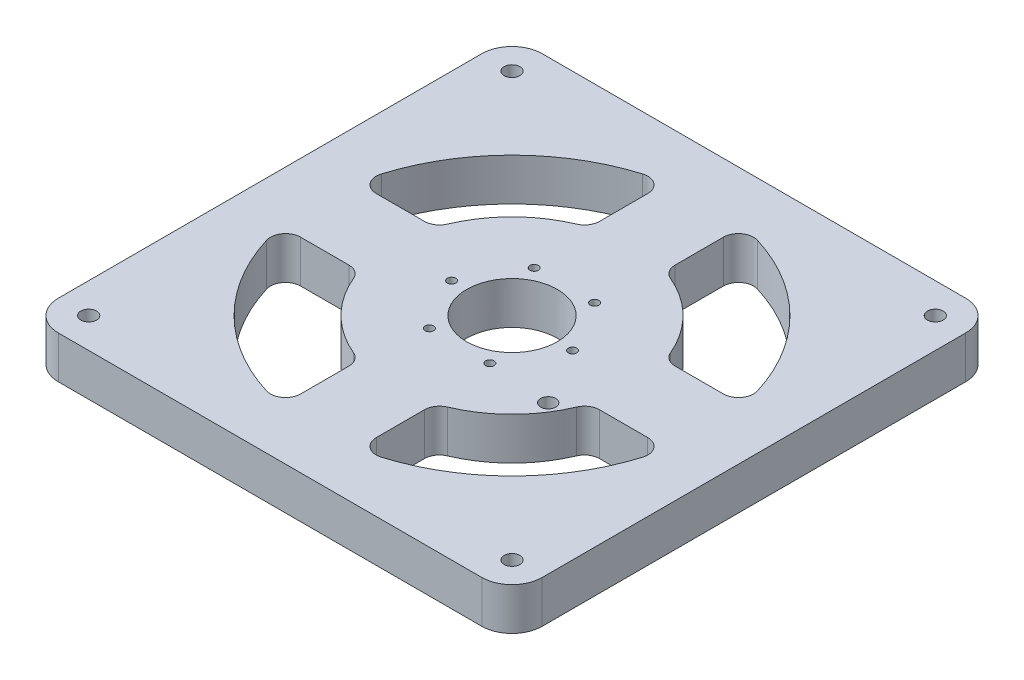
from build123d import *

# Parameters (mm, degrees)
SKETCH_1_W          = 160
SKETCH_1_H          = 160
EXTRUDE_1_DEPTH     = 14
SKETCH_2_R          = 15
SKETCH_2_R_2        = 1.4
CUT_EXTRUDE_1_DEPTH = 16
SKETCH_3_R          = 2.6
CUT_EXTRUDE_2_DEPTH = 20
FILLET_1_R          = 10
SKETCH_5_R          = 3.5
CUT_EXTRUDE_3_DEPTH = 4
CUT_EXTRUDE_4_DEPTH = 20
SKETCH_7_R          = 2.5
CUT_EXTRUDE_5_DEPTH = 20
FILLET_2_R          = 5
FILLET_3_R          = 5


with BuildPart() as part:
    # 草图1 → 凸台-拉伸1 (new body)
    with BuildSketch(Plane(origin=(0, 0, 0), x_dir=(1, 0, 0), z_dir=(0, 1, 0))):
        with Locations((80, 80)):
            Rectangle(SKETCH_1_W, SKETCH_1_H)
    extrude(amount=EXTRUDE_1_DEPTH)

    # 草图2 → 切除-拉伸1 (cut)
    with BuildSketch(Plane(origin=(0, 14, 0), x_dir=(1, 0, 0), z_dir=(0, 1, 0))):
        with Locations(Location((80, 80, 0), (0, 0, 270))):
            Circle(SKETCH_2_R)
        with Locations(Location((60, 80, 0), (0, 0, 270))):
            Circle(SKETCH_2_R_2)
        with Locations(Location((70, 97.320508076, 0), (0, 0, 270))):
            Circle(SKETCH_2_R_2)
        with Locations(Location((90, 97.320508076, 0), (0, 0, 270))):
            Circle(SKETCH_2_R_2)
        with Locations(Location((100, 80, 0), (0, 0, 270))):
            Circle(SKETCH_2_R_2)
        with Locations(Location((90, 62.679491924, 0), (0, 0, 270))):
            Circle(SKETCH_2_R_2)
        with Locations(Location((70, 62.679491924, 0), (0, 0, 270))):
            Circle(SKETCH_2_R_2)
    extrude(amount=-CUT_EXTRUDE_1_DEPTH, mode=Mode.SUBTRACT)

    # 草图3 → 切除-拉伸2 (cut)
    with BuildSketch(Plane(origin=(0, 14, 0), x_dir=(1, 0, 0), z_dir=(0, 1, 0))):
        with Locations(Location((10, 150, 0), (0, 0, 270))):
            Circle(SKETCH_3_R)
        with Locations(Location((150, 150, 0), (0, 0, 90))):
            Circle(SKETCH_3_R)
        with Locations(Location((150, 10, 0), (0, 0, 270))):
            Circle(SKETCH_3_R)
        with Locations(Location((10, 10, 0), (0, 0, 90))):
            Circle(SKETCH_3_R)
    extrude(amount=-CUT_EXTRUDE_2_DEPTH, mode=Mode.SUBTRACT)

    # 圆角1
    fillet_1_edges = [part.edges().sort_by_distance(p)[0] for p in [
        (0, 7, -160),
        (160, 7, -160),
        (160, 7, 0),
        (0, 7, 0),
    ]]
    fillet(fillet_1_edges, radius=FILLET_1_R)

    # 草图5 → 切除-拉伸3 (cut)
    with BuildSketch(Plane.XZ):
        with Locations(Location((100, -80, 0), (0, 0, 270))):
            Circle(SKETCH_5_R)
        with Locations(Location((90, -97.320508076, 0), (0, 0, 270))):
            Circle(SKETCH_5_R)
        with Locations(Location((70, -97.320508076, 0), (0, 0, 270))):
            Circle(SKETCH_5_R)
        with Locations(Location((60, -80, 0), (0, 0, 270))):
            Circle(SKETCH_5_R)
        with Locations(Location((70, -62.679491924, 0), (0, 0, 270))):
            Circle(SKETCH_5_R)
        with Locations(Location((90, -62.679491924, 0), (0, 0, 270))):
            Circle(SKETCH_5_R)
    extrude(amount=-CUT_EXTRUDE_3_DEPTH, mode=Mode.SUBTRACT)

    # 草图6 → 切除-拉伸4 (cut)
    with BuildSketch(Plane(origin=(0, 14, 0), x_dir=(1, 0, 0), z_dir=(0, 1, 0))):
        with BuildLine():
            ThreePointArc((67.5, 143.786754111), (34.038059223, 125.961940777), (16.213245889, 92.5))
            Line((16.213245889, 92.5), (42.003289616, 92.5))
            ThreePointArc((42.003289616, 92.5), (51.715728753, 108.284271247), (67.5, 117.996710384))
            Line((67.5, 117.996710384), (67.5, 143.786754111))
        make_face()
        with BuildLine():
            ThreePointArc((143.786754111, 92.5), (125.961940777, 125.961940777), (92.5, 143.786754111))
            Line((92.5, 143.786754111), (92.5, 117.996710384))
            ThreePointArc((92.5, 117.996710384), (108.284271247, 108.284271247), (117.996710384, 92.5))
            Line((117.996710384, 92.5), (143.786754111, 92.5))
        make_face()
        with BuildLine():
            Line((92.5, 42.003289616), (92.5, 16.213245889))
            ThreePointArc((92.5, 16.213245889), (125.961940777, 34.038059223), (143.786754111, 67.5))
            Line((143.786754111, 67.5), (117.996710384, 67.5))
            ThreePointArc((117.996710384, 67.5), (108.284271247, 51.715728753), (92.5, 42.003289616))
        make_face()
        with BuildLine():
            Line((42.003289616, 67.5), (16.213245889, 67.5))
            ThreePointArc((16.213245889, 67.5), (34.038059223, 34.038059223), (67.5, 16.213245889))
            Line((67.5, 16.213245889), (67.5, 42.003289616))
            ThreePointArc((67.5, 42.003289616), (51.715728753, 51.715728753), (42.003289616, 67.5))
        make_face()
    extrude(amount=-CUT_EXTRUDE_4_DEPTH, mode=Mode.SUBTRACT)

    # 草图7 → 切除-拉伸5 (cut)
    with BuildSketch(Plane(origin=(0, 14, 0), x_dir=(1, 0, 0), z_dir=(0, 1, 0))):
        with Locations(Location((110.973206237, 60.993261842, 0), (0, 0, 270))):
            Circle(SKETCH_7_R)
    extrude(amount=-CUT_EXTRUDE_5_DEPTH, mode=Mode.SUBTRACT)

    # 圆角2
    fillet_2_edges = [part.edges().sort_by_distance(p)[0] for p in [
        (67.5, 7, -143.786754111),
        (67.5, 7, -117.996710384),
        (42.003289616, 7, -92.5),
        (16.213245889, 7, -92.5),
    ]]
    fillet(fillet_2_edges, radius=FILLET_2_R)

    # 圆角3
    fillet_3_edges = [part.edges().sort_by_distance(p)[0] for p in [
        (16.213245889, 7, -67.5),
        (42.003289616, 7, -67.5),
        (67.5, 7, -42.003289616),
        (67.5, 7, -16.213245889),
        (92.5, 7, -16.213245889),
        (92.5, 7, -42.003289616),
        (117.996710384, 7, -67.5),
        (143.786754111, 7, -67.5),
        (143.786754111, 7, -92.5),
        (117.996710384, 7, -92.5),
        (92.5, 7, -117.996710384),
        (92.5, 7, -143.786754111),
    ]]
    fillet(fillet_3_edges, radius=FILLET_3_R)


solid = part.part
